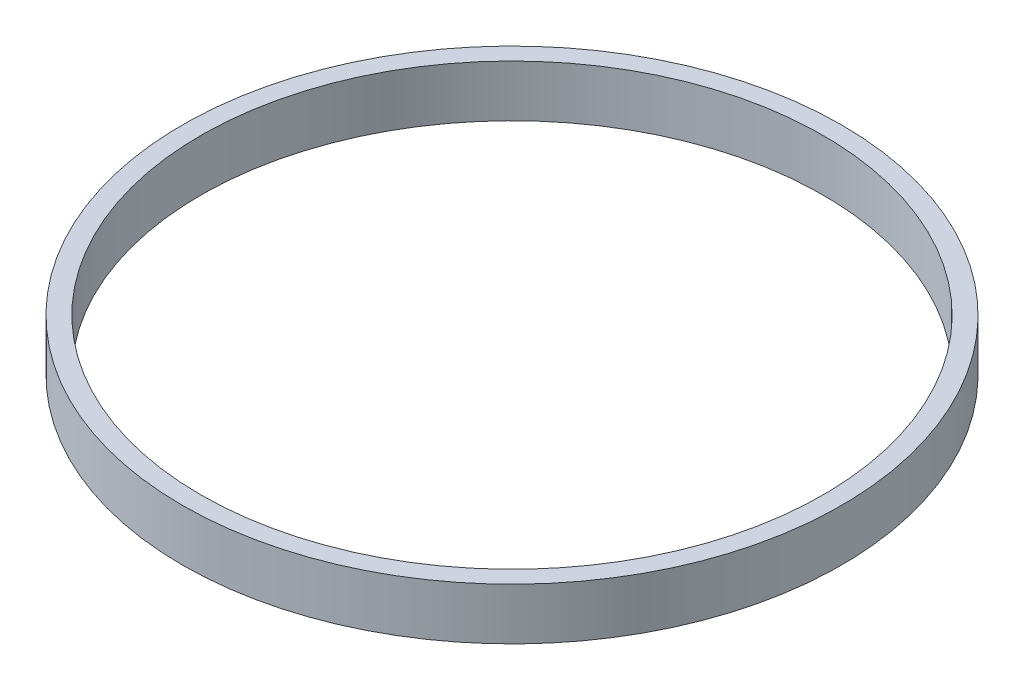
from build123d import *

# Parameters (mm, degrees)
SKETCH2_R           = 36
SKETCH2_R_2         = 34
BOSS_EXTRUDE1_DEPTH = 5.65


with BuildPart() as part:
    # Sketch2 → Boss-Extrude1 (new body)
    with BuildSketch(Plane(origin=(0, 0, 0), x_dir=(1, 0, 0), z_dir=(0, 1, 0))):
        with Locations(Location((0, 0, 0), (0, 0, 270))):
            Circle(SKETCH2_R)
        with Locations(Location((0, 0, 0), (0, 0, 270))):
            Circle(SKETCH2_R_2, mode=Mode.SUBTRACT)
    extrude(amount=BOSS_EXTRUDE1_DEPTH)


solid = part.part
